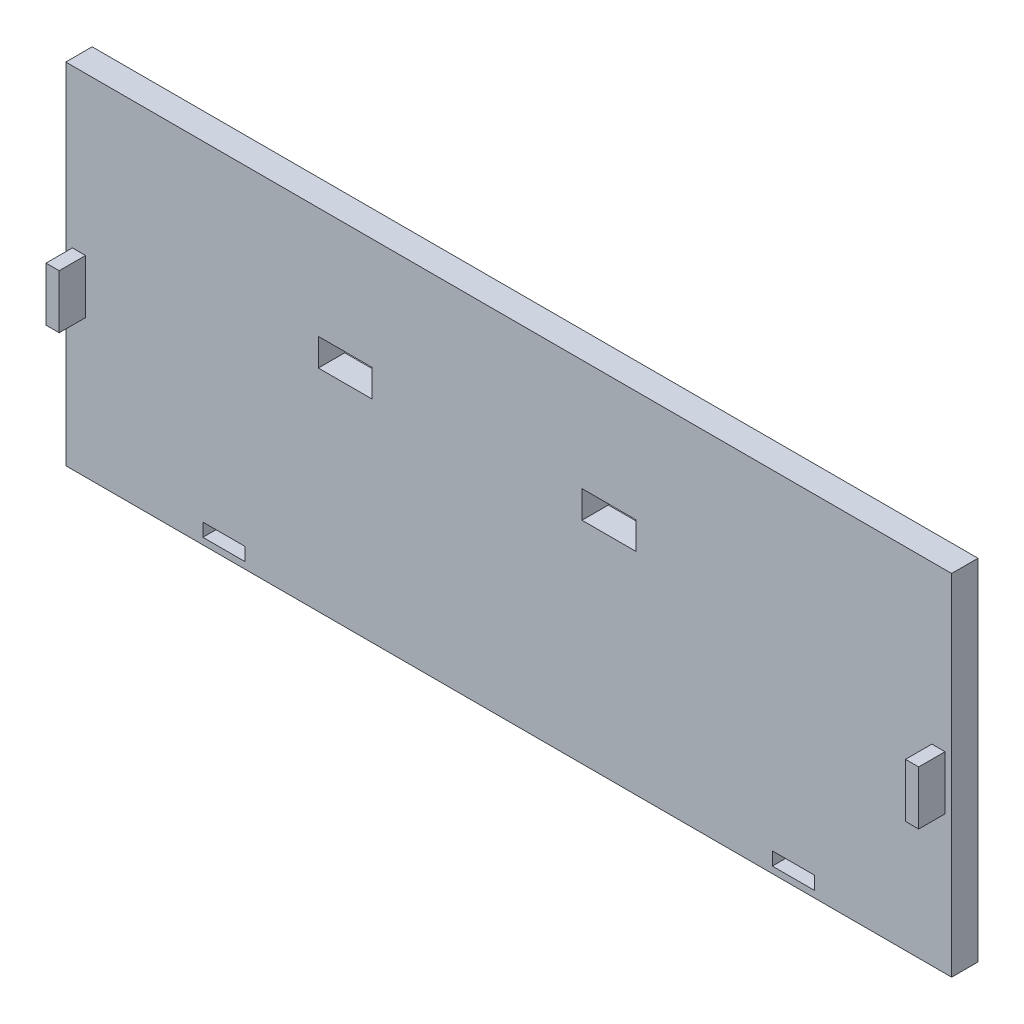
from build123d import *

# Parameters (mm, degrees)
CROQUIS2_W              = 168
CROQUIS2_H              = 66.31
SALIENTE_EXTRUIR1_DEPTH = 5
CROQUIS3_W              = 2.5
CROQUIS3_H              = 10.2
SALIENTE_EXTRUIR3_DEPTH = 5
CROQUIS5_W              = 10.2
CROQUIS5_H              = 5.2
CORTAR_EXTRUIR2_DEPTH   = 181.68208572
CROQUIS7_W              = 8
CROQUIS7_H              = 2.5
CORTAR_EXTRUIR3_DEPTH   = 181.68208572
SKETCH1_W               = 2.5
SKETCH1_H               = 10.2
BOSS_EXTRUDE1_DEPTH     = 5


with BuildPart() as part:
    # Croquis2 → Saliente-Extruir1 (new body)
    with BuildSketch(Plane.XY):
        with Locations((84, 33.155)):
            Rectangle(CROQUIS2_W, CROQUIS2_H)
    extrude(amount=-SALIENTE_EXTRUIR1_DEPTH)

    # Croquis3 → Saliente-Extruir3 (add)
    with BuildSketch(Plane.XY):
        with Locations((2.5, 31.31)):
            Rectangle(CROQUIS3_W, CROQUIS3_H)
    extrude(amount=SALIENTE_EXTRUIR3_DEPTH)

    # Croquis5 → Cortar-Extruir2 (cut, through all)
    with BuildSketch(Plane.XY):
        with Locations((103, 42.6)):
            Rectangle(CROQUIS5_W, CROQUIS5_H)
        with Locations((53, 42.6)):
            Rectangle(CROQUIS5_W, CROQUIS5_H)
    extrude(amount=-CORTAR_EXTRUIR2_DEPTH, mode=Mode.SUBTRACT)

    # Croquis7 → Cortar-Extruir3 (cut, through all)
    with BuildSketch(Plane.XY):
        with Locations((30, 2.5)):
            Rectangle(CROQUIS7_W, CROQUIS7_H)
        with Locations((138, 2.5)):
            Rectangle(CROQUIS7_W, CROQUIS7_H)
    extrude(amount=-CORTAR_EXTRUIR3_DEPTH, mode=Mode.SUBTRACT)

    # Sketch1 → Boss-Extrude1 (add)
    with BuildSketch(Plane.XY):
        with Locations((165.5, 31.31)):
            Rectangle(SKETCH1_W, SKETCH1_H)
    extrude(amount=BOSS_EXTRUDE1_DEPTH)


solid = part.part
